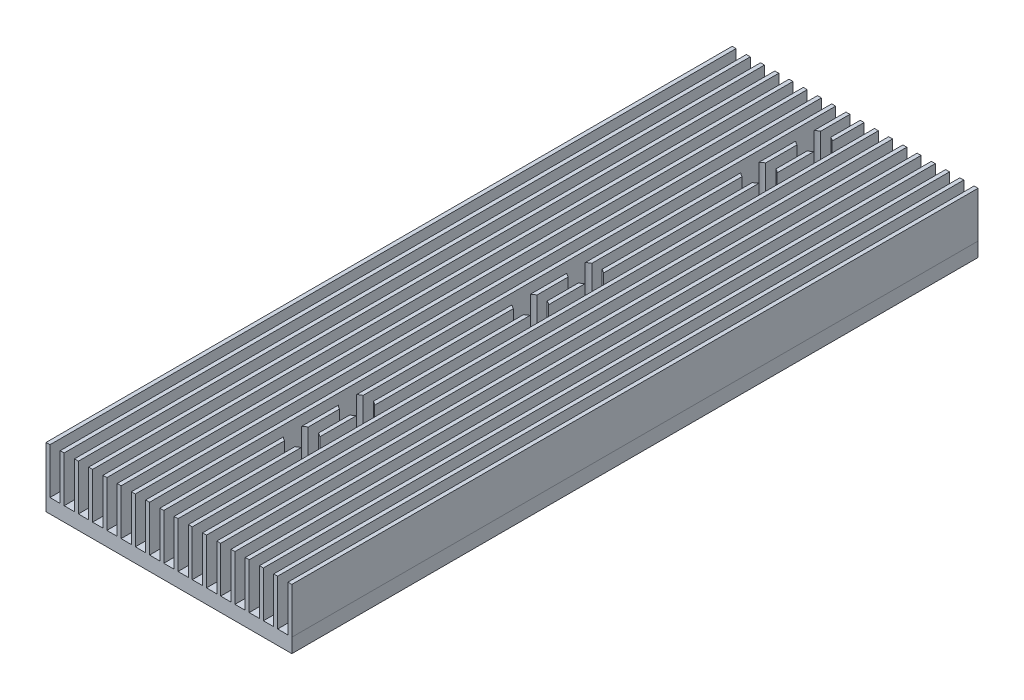
from build123d import *

# Parameters (mm, degrees)
SKETCH1_W          = 136.525
SKETCH1_H          = 381
EXTRUDE1_DEPTH     = 7.9248
SKETCH4_W          = 2.1844
SKETCH4_H          = 381
EXTRUDE2_DEPTH     = 25.4
LPATTERN1_COUNT    = 18
LPATTERN1_PITCH    = 7.902448
SKETCH6_R          = 3.175
CUT_EXTRUDE2_DEPTH = 10.16
SKETCH7_R          = 7.14375
CUT_EXTRUDE3_DEPTH = 406.518819594


with BuildPart() as part:
    # Sketch1 → Extrude1 (new body)
    with BuildSketch(Plane(origin=(0, 0, 0), x_dir=(1, 0, 0), z_dir=(0, 1, 0))):
        with Locations((68.2625, 190.5)):
            Rectangle(SKETCH1_W, SKETCH1_H)
    extrude(amount=EXTRUDE1_DEPTH)

    # Sketch4 → Extrude2 (add)
    with BuildSketch(Plane(origin=(0, 7.9248, 0), x_dir=(-1, 0, 0), z_dir=(0, 1, 0))):
        with Locations((-1.0922, -190.5)):
            Rectangle(SKETCH4_W, SKETCH4_H)
    extrude2 = extrude(amount=EXTRUDE2_DEPTH)

    # LPattern1: Extrude2 ×18
    with Locations(*[(i * LPATTERN1_PITCH, 0, 0) for i in range(1, LPATTERN1_COUNT)]):
        add(extrude2)

    # Sketch6 → Cut-Extrude2 (cut)
    with BuildSketch(Plane(origin=(0, 0, 0), x_dir=(1, 0, 0), z_dir=(0, 1, 0))):
        with Locations(Location((68.2625, 358.14, 0), (0, 0, 154.200161739))):
            Circle(SKETCH6_R)
        with Locations(Location((68.2625, 327.66, 0), (0, 0, 154.200161739))):
            Circle(SKETCH6_R)
        with Locations(Location((68.2625, 200.66, 0), (0, 0, 154.200161739))):
            Circle(SKETCH6_R)
        with Locations(Location((68.2625, 231.14, 0), (0, 0, 154.200161739))):
            Circle(SKETCH6_R)
        with Locations(Location((68.2625, 73.66, 0), (0, 0, 154.200161739))):
            Circle(SKETCH6_R)
        with Locations(Location((68.2625, 104.14, 0), (0, 0, 154.200161739))):
            Circle(SKETCH6_R)
    extrude(amount=CUT_EXTRUDE2_DEPTH, mode=Mode.SUBTRACT)

    # Sketch7 → Cut-Extrude3 (cut, through all)
    with BuildSketch(Plane(origin=(0, 7.9248, 0), x_dir=(-1, 0, 0), z_dir=(0, 1, 0))):
        with Locations((-68.2625, -358.14)):
            Circle(SKETCH7_R)
        with Locations((-68.2625, -327.66)):
            Circle(SKETCH7_R)
        with Locations((-68.2625, -231.14)):
            Circle(SKETCH7_R)
        with Locations((-68.2625, -200.66)):
            Circle(SKETCH7_R)
        with Locations((-68.2625, -73.66)):
            Circle(SKETCH7_R)
        with Locations((-68.2625, -104.14)):
            Circle(SKETCH7_R)
    extrude(amount=CUT_EXTRUDE3_DEPTH, mode=Mode.SUBTRACT)


solid = part.part
